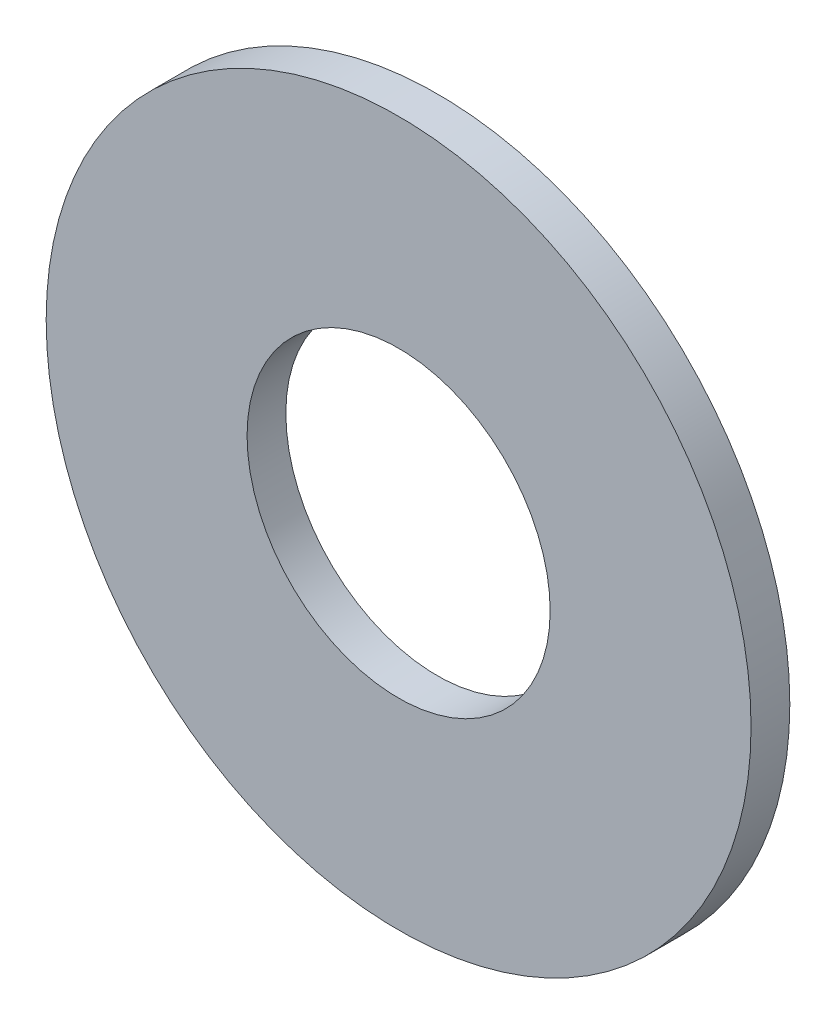
from build123d import *

# Parameters (mm, degrees)
SKETCH1_R           = 12.7
SKETCH1_R_2         = 5.461
BOSS_EXTRUDE1_DEPTH = 1.397


with BuildPart() as part:
    # Sketch1 → Boss-Extrude1 (new body)
    with BuildSketch(Plane.XY):
        Circle(SKETCH1_R)
        Circle(SKETCH1_R_2, mode=Mode.SUBTRACT)
    extrude(amount=BOSS_EXTRUDE1_DEPTH)


solid = part.part
